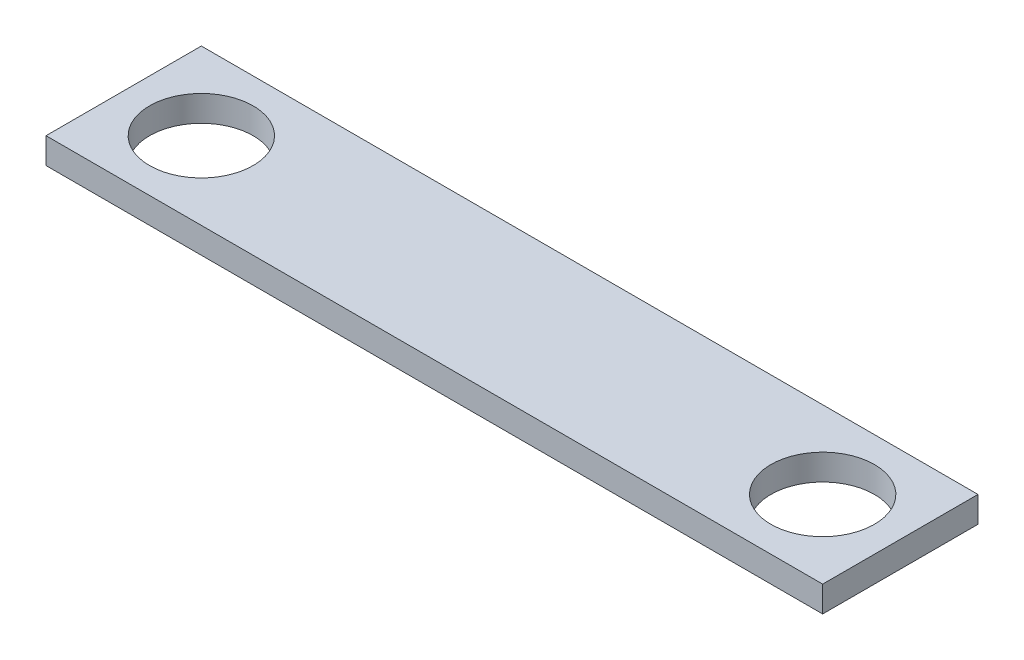
from build123d import *

# Parameters (mm, degrees)
SKETCH1_W           = 60
SKETCH1_H           = 12
BOSS_EXTRUDE1_DEPTH = 2
SKETCH2_R           = 4
CUT_EXTRUDE1_DEPTH  = 62.22091146


with BuildPart() as part:
    # Sketch1 → Boss-Extrude1 (new body)
    with BuildSketch(Plane(origin=(0, 0, 0), x_dir=(1, 0, 0), z_dir=(0, 1, 0))):
        with Locations((30, 6)):
            Rectangle(SKETCH1_W, SKETCH1_H)
    extrude(amount=BOSS_EXTRUDE1_DEPTH)

    # Sketch2 → Cut-Extrude1 (cut, through all)
    with BuildSketch(Plane(origin=(0, 2, 0), x_dir=(1, 0, 0), z_dir=(0, 1, 0))):
        with Locations(Location((6, 6, 0), (0, 0, 270))):
            Circle(SKETCH2_R)
        with Locations(Location((54, 6, 0), (0, 0, 90))):
            Circle(SKETCH2_R)
    extrude(amount=-CUT_EXTRUDE1_DEPTH, mode=Mode.SUBTRACT)


solid = part.part
